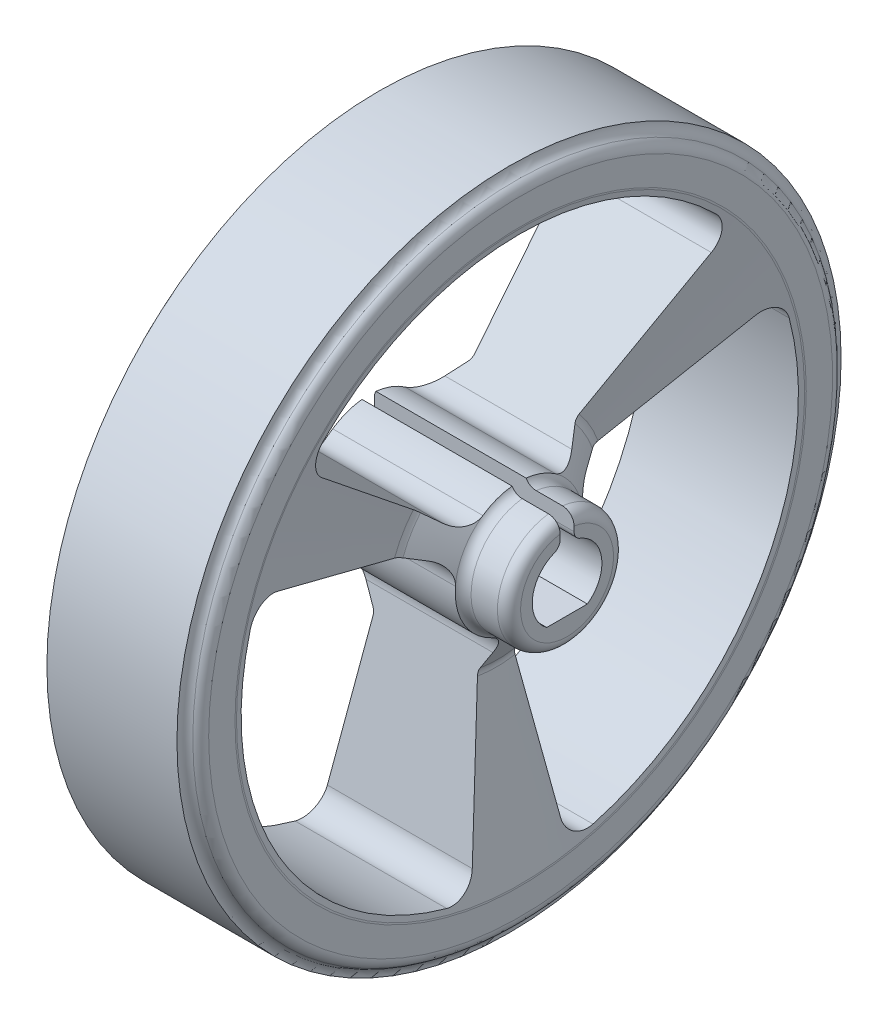
from build123d import *

# Parameters (mm, degrees)
CUT_EXTRUDE2_DEPTH = 22.975895886
CIRPATTERN1_COUNT  = 3
CUT_EXTRUDE3_DEPTH = 22.975895886


with BuildPart() as part:
    # Sketch1 → Revolve1 (revolve)
    with BuildSketch(Plane(origin=(0, 0, 0), x_dir=(1, 0, 0), z_dir=(0, 1, 0)), mode=Mode.PRIVATE) as revolve1_sk:
        with BuildLine():
            Line((0, 0), (0, 2.5))
            ThreePointArc((0, 2.5), (0.017037087, 2.629409523), (0.066987298, 2.75))
            Line((0.066987298, 2.75), (0.98771433, 4.344746))
            ThreePointArc((0.98771433, 4.344746), (1.045401255, 4.498757059), (1.05, 4.663153041))
            Line((1.05, 4.663153041), (0.004701629, 12.231592959))
            ThreePointArc((0.004701629, 12.231592959), (0.001176792, 12.265715789), (0, 12.3))
            Line((0, 12.3), (0, 13.433974596))
            ThreePointArc((0, 13.433974596), (0.066987298, 13.683974596), (0.25, 13.866987298))
            ThreePointArc((0.25, 13.866987298), (0.433012702, 14.05), (0.5, 14.3))
            Line((0.5, 14.3), (6.1, 14.3))
            ThreePointArc((6.1, 14.3), (6.166987298, 14.05), (6.35, 13.866987298))
            ThreePointArc((6.35, 13.866987298), (6.533012702, 13.683974596), (6.6, 13.433974596))
            Line((6.6, 13.433974596), (6.6, 12.3))
            ThreePointArc((6.6, 12.3), (6.598823208, 12.265715789), (6.595298371, 12.231592959))
            Line((6.595298371, 12.231592959), (5.55, 4.663153041))
            ThreePointArc((5.55, 4.663153041), (5.554598745, 4.498757059), (5.61228567, 4.344746))
            Line((5.61228567, 4.344746), (6.533012702, 2.75))
            ThreePointArc((6.533012702, 2.75), (6.716025404, 2.566987298), (6.966025404, 2.5))
            Line((6.966025404, 2.5), (8.1, 2.5))
            ThreePointArc((8.1, 2.5), (8.453553391, 2.353553391), (8.6, 2))
            Line((8.6, 2), (8.6, 0))
            Line((8.6, 0), (0, 0))
        make_face()
    revolve(revolve1_sk.sketch.rotate(Axis((0, 0, 0), (1, 0, 0)), 180), axis=Axis((0, 0, 0), (1, 0, 0)))

    # Sketch2 → Cut-Extrude2 (cut, symmetric)
    with BuildSketch(Plane(origin=(0, 0, 0), x_dir=(0, 0, -1), z_dir=(1, 0, 0))):
        with BuildLine():
            Line((8.391596431, 7.04138547), (2.768644011, 2.323168169))
            ThreePointArc((2.768644011, 2.323168169), (2.17353825, 2.090350038), (1.558961361, 2.265422582))
            ThreePointArc((1.558961361, 2.265422582), (0, 2.75), (-1.558961361, 2.265422582))
            ThreePointArc((-1.558961361, 2.265422582), (-2.17353825, 2.090350038), (-2.768644011, 2.323168169))
            Line((-2.768644011, 2.323168169), (-8.391596431, 7.04138547))
            ThreePointArc((-8.391596431, 7.04138547), (-8.747937455, 7.765692967), (-8.453245987, 8.517196269))
            ThreePointArc((-8.453245987, 8.517196269), (0, 12), (8.453245987, 8.517196269))
            ThreePointArc((8.453245987, 8.517196269), (8.747937455, 7.765692967), (8.391596431, 7.04138547))
        make_face()
    cut_extrude2 = extrude(amount=CUT_EXTRUDE2_DEPTH, both=True, mode=Mode.SUBTRACT)

    # CirPattern1: Cut-Extrude2 ×3 about axis
    cirpattern1_axis = Axis((0, 0, 0), (1, 0, 0))
    for i in range(1, CIRPATTERN1_COUNT):
        add(cut_extrude2.rotate(cirpattern1_axis, i * 360 / CIRPATTERN1_COUNT), mode=Mode.SUBTRACT)

    # Sketch3 → Cut-Extrude3 (cut, through all)
    with BuildSketch(Plane.ZY):
        with BuildLine():
            Line((0.875, -1.218349293), (-0.875, -1.218349293))
            ThreePointArc((-0.875, -1.218349293), (-1.48871199, 0.183675284), (-0.552631579, 1.394488558))
            ThreePointArc((-0.552631579, 1.394488558), (-0.369131923, 1.541571578), (-0.3, 1.766352173))
            Line((-0.3, 1.766352173), (-0.3, 2.733587387))
            ThreePointArc((-0.3, 2.733587387), (0, 2.75), (0.3, 2.733587387))
            Line((0.3, 2.733587387), (0.3, 1.766352173))
            ThreePointArc((0.3, 1.766352173), (0.369131923, 1.541571578), (0.552631579, 1.394488558))
            ThreePointArc((0.552631579, 1.394488558), (1.48871199, 0.183675284), (0.875, -1.218349293))
        make_face()
    extrude(amount=-CUT_EXTRUDE3_DEPTH, mode=Mode.SUBTRACT)


solid = part.part
